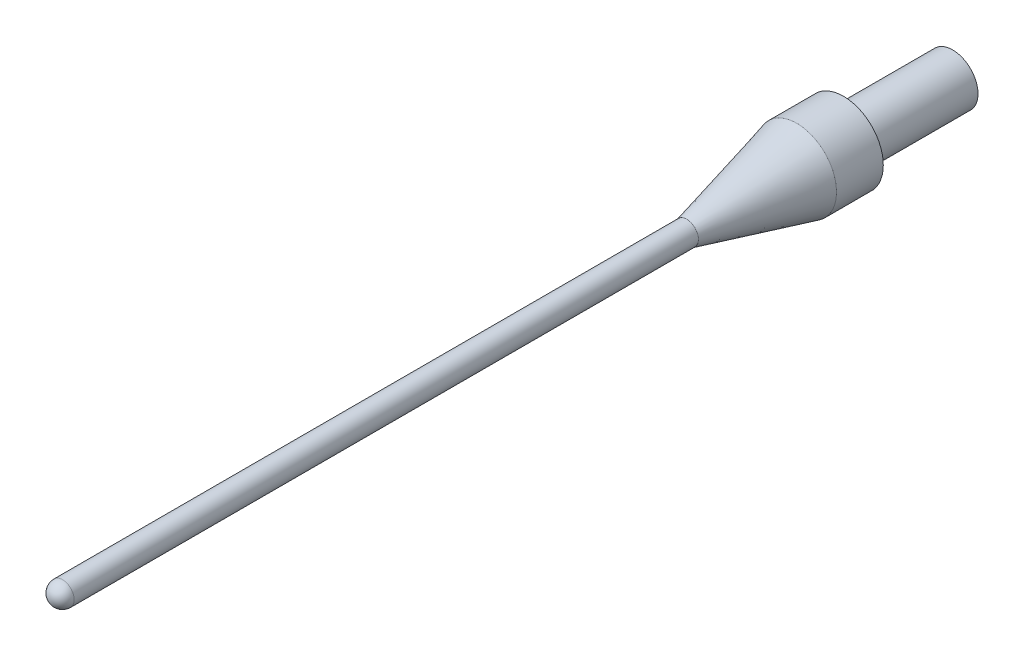
from build123d import *

# Parameters (mm, degrees)
ESQUISSE1_R             = 8.5
BOSS_EXTRU_1_DEPTH      = 10
ESQUISSE2_R             = 2.5
BOSS_EXTRU_2_DEPTH      = 157
ECHELLE2_SCALE          = 0.6
ESQUISSE5_R             = 3.25
BOSS_EXTRU_4_DEPTH      = 14
ESQUISSE6_R             = 1
ENL_V_MAT_EXTRU_1_DEPTH = 17
D_ME1_FACE_RADIUS       = 1.5
D_ME1_HEIGHT            = 1.5


with BuildPart() as part:
    # Esquisse1 → Boss.-Extru.1 (new body)
    with BuildSketch(Plane.XY):
        Circle(ESQUISSE1_R)
    extrude(amount=BOSS_EXTRU_1_DEPTH)

    # Esquisse2 → Boss.-Extru.2 (add)
    with BuildSketch(Plane.XY.offset(10)):
        Circle(ESQUISSE2_R)
    extrude(amount=BOSS_EXTRU_2_DEPTH)


with BuildPart() as part_1:
    # Echelle2: scaled about (0, 0, 0)
    add(part.part.scale(ECHELLE2_SCALE))

    # Esquisse5 → Boss.-Extru.4 (add)
    with BuildSketch(Plane(origin=(0, 0, 0), x_dir=(-1, 0, 0), z_dir=(0, 0, -1))):
        with Locations(Location((0, 0, 0), (0, 0, 180))):
            Circle(ESQUISSE5_R)
    extrude(amount=BOSS_EXTRU_4_DEPTH)

    # Esquisse6 → Enlèv. mat.-Extru.1 (cut)
    with BuildSketch(Plane(origin=(0, 0, -14), x_dir=(-1, 0, 0), z_dir=(0, 0, -1))):
        Circle(ESQUISSE6_R)
    extrude(amount=-ENL_V_MAT_EXTRU_1_DEPTH, mode=Mode.SUBTRACT)

    # Esquisse8 → Révolution1 (revolve)
    with BuildSketch(Plane(origin=(0, 0, 0), x_dir=(1, 0, 0), z_dir=(0, 1, 0)), mode=Mode.PRIVATE) as r_volution1_sk:
        Polygon((5.1, -6), (0, -6), (0, -26), align=None)
    revolve(r_volution1_sk.sketch.rotate(Axis((0, 0, 6), (0, 0, 1)), 180), axis=Axis((0, 0, 6), (0, 0, 1)))

    # Dôme1: a dome of height H over a round flat face of radius A is a cap of a sphere of radius (A * A + H * H) / (2 * H)
    d_me1_r = (D_ME1_FACE_RADIUS * D_ME1_FACE_RADIUS + D_ME1_HEIGHT * D_ME1_HEIGHT) / (2 * D_ME1_HEIGHT)
    d_me1_base = Plane((0, 0, 100.2), z_dir=(0, 0, 1))
    with Locations(d_me1_base.offset(D_ME1_HEIGHT - d_me1_r)):
        d_me1_ball = Sphere(d_me1_r, mode=Mode.PRIVATE)
    add(split(d_me1_ball, bisect_by=d_me1_base, keep=Keep.TOP, mode=Mode.PRIVATE))


solid = part_1.part
